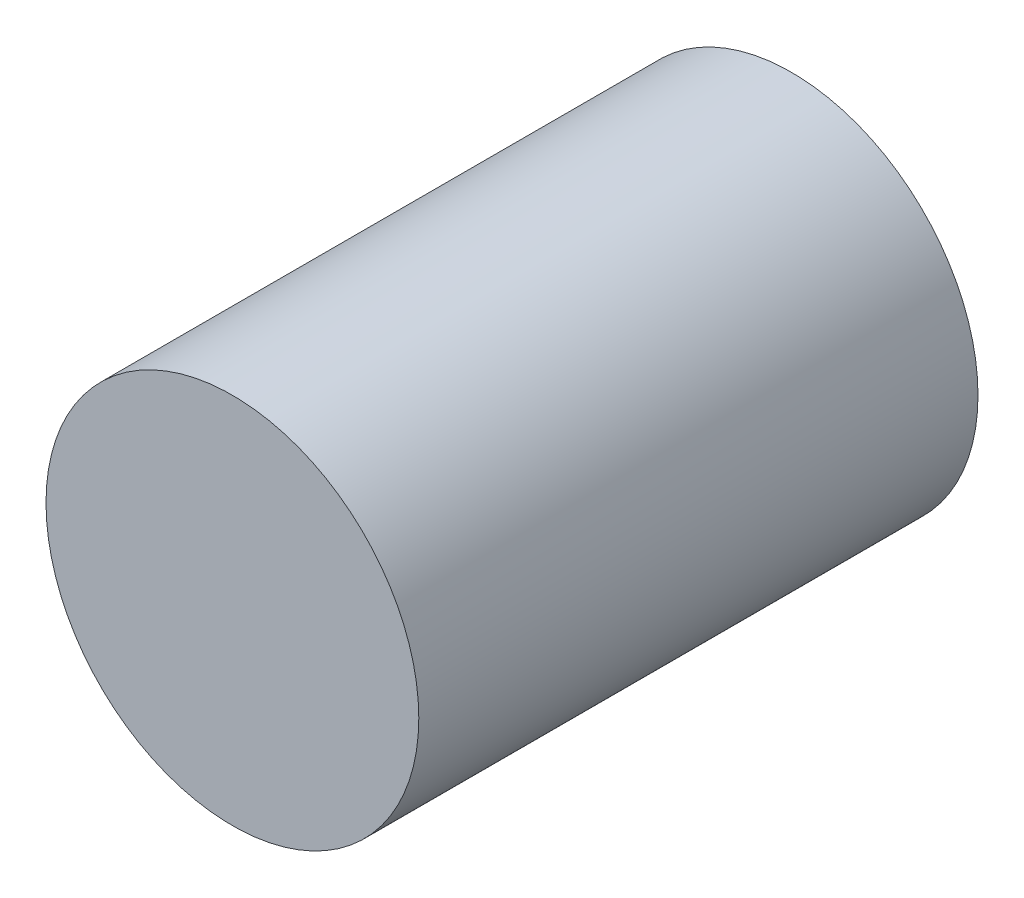
from build123d import *

# Parameters (mm, degrees)
ESBO_O1_R                = 1
RESSALTO_EXTRUS_O1_DEPTH = 3


with BuildPart() as part:
    # Esboço1 → Ressalto-extrusão1 (new body)
    with BuildSketch(Plane.XY):
        Circle(ESBO_O1_R)
    extrude(amount=RESSALTO_EXTRUS_O1_DEPTH)


solid = part.part
